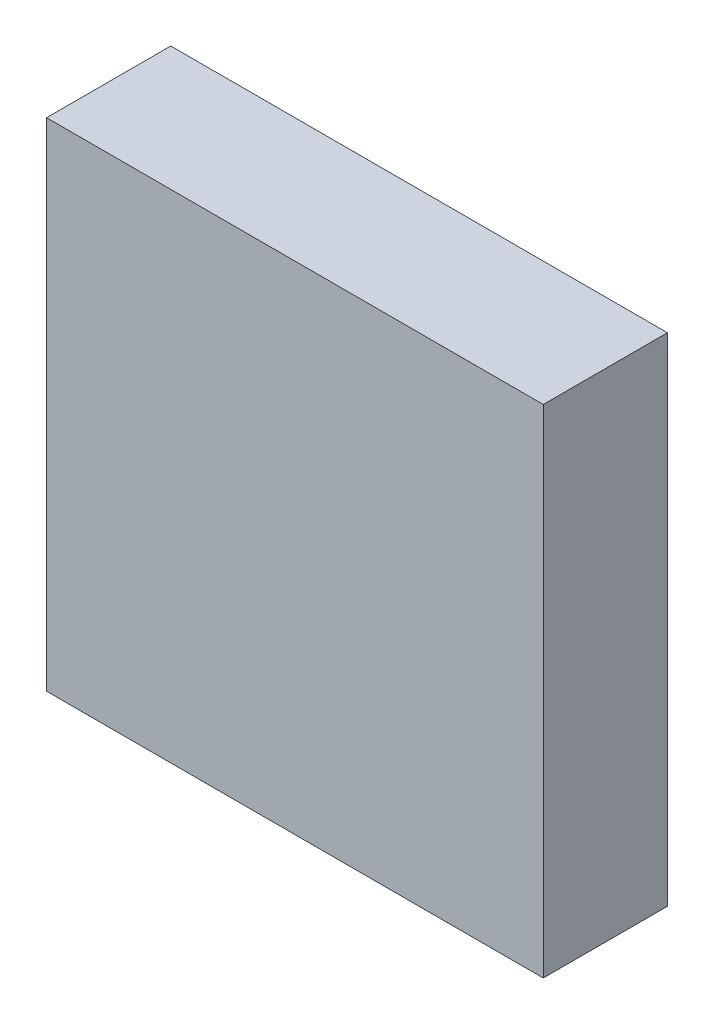
from build123d import *

# Parameters (mm, degrees)
ESQUISSE1_W      = 200
ESQUISSE1_H      = 200
EXTRUSION1_DEPTH = 50


with BuildPart() as part:
    # Esquisse1 → Extrusion1 (new body)
    with BuildSketch(Plane.XY):
        Rectangle(ESQUISSE1_W, ESQUISSE1_H)
    extrude(amount=EXTRUSION1_DEPTH)


solid = part.part
